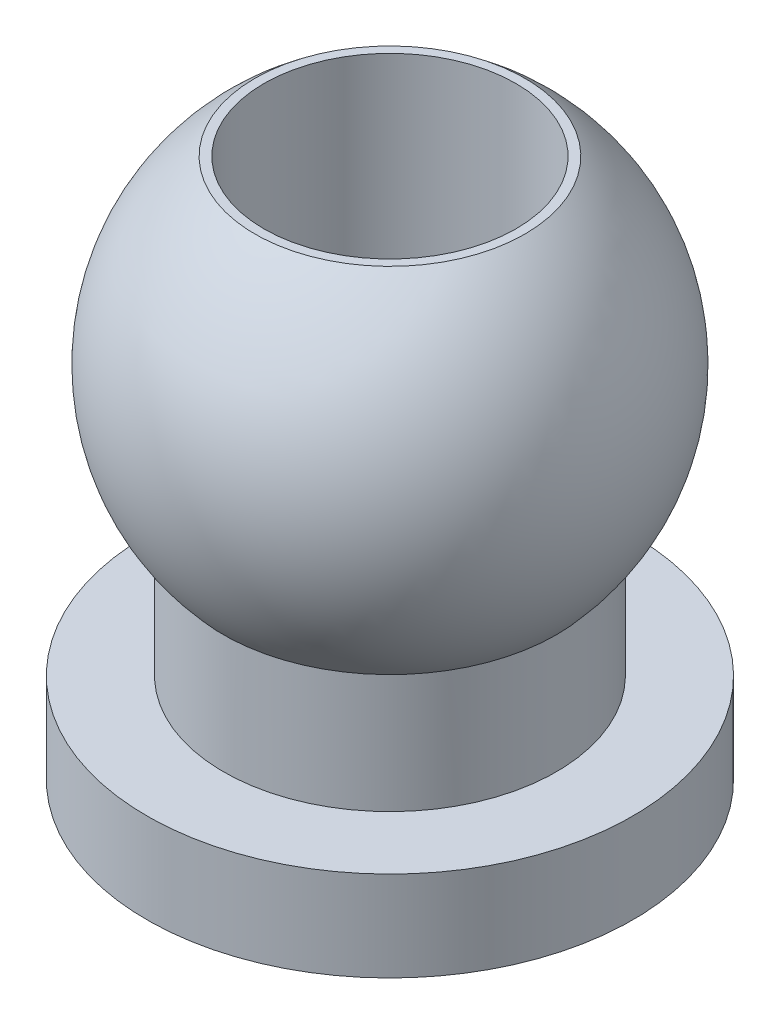
from build123d import *


with BuildPart() as part:
    # Esquisse1 → Révolution1 (revolve)
    with BuildSketch(Plane.XY, mode=Mode.PRIVATE) as r_volution1_sk:
        with BuildLine():
            Line((1.5, 2), (1.4, 2))
            Line((1.4, 2), (1.4, -4))
            Line((1.4, -4), (2.7, -4))
            Line((2.7, -4), (2.7, -3))
            Line((2.7, -3), (1.85, -3))
            Line((1.85, -3), (1.85, -1.681517172))
            ThreePointArc((1.85, -1.681517172), (2.488778249, 0.236606906), (1.5, 2))
        make_face()
    revolve(r_volution1_sk.sketch.rotate(Axis((0, 2, 0), (0, -1, 0)), 180), axis=Axis((0, 2, 0), (0, -1, 0)))


solid = part.part
